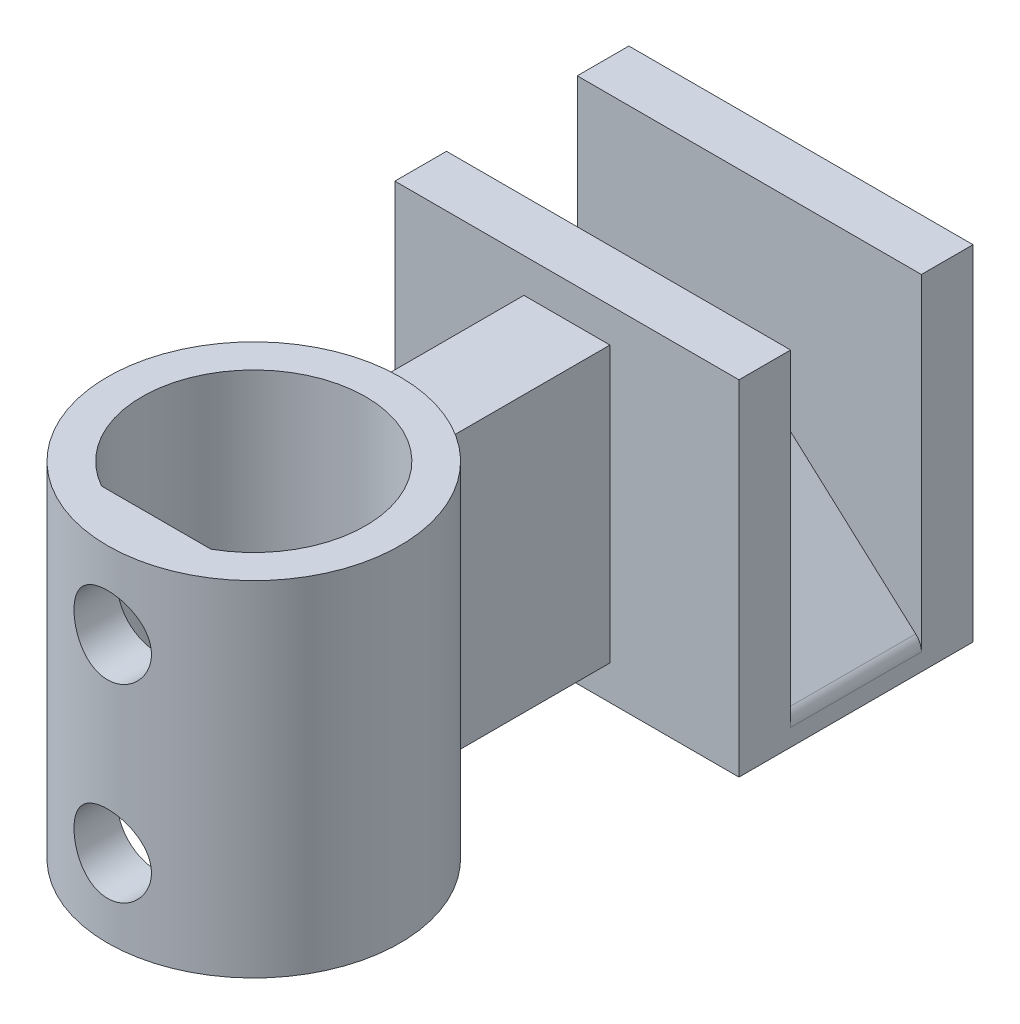
from build123d import *

# Parameters (mm, degrees)
SKETCH2_W                       = 20
SKETCH2_H                       = 10
BOSS_EXTRUDE1_DEPTH             = 3.8
CHAMFER1_SIZE                   = 9.5
CHAMFER1_SIZE2                  = 8.553838421
FILLET3_R                       = 1
SKETCH3_W                       = 20
SKETCH3_H                       = 20
BOSS_EXTRUDE2_DEPTH             = 3
BOSS_EXTRUDE3_REACH             = 21.268
SKETCH6_R                       = 8.5
BOSS_EXTRUDE3_DIRECTION_2_REACH = 21.268
BOSS_EXTRUDE4_REACH             = 34.216
BOSS_EXTRUDE4_END_RADIUS        = 8.5
SKETCH5_W                       = 5
SKETCH5_H                       = 16
CUT_EXTRUDE1_REACH              = 34.299
CUT_EXTRUDE1_END_RADIUS         = 8.5
SKETCH7_R                       = 2.25


with BuildPart() as part:
    # Sketch2 → Boss-Extrude1 (new, symmetric)
    with BuildSketch(Plane.XY):
        Rectangle(SKETCH2_W, SKETCH2_H)
    extrude(amount=BOSS_EXTRUDE1_DEPTH, both=True)

    # Chamfer1
    chamfer1_edges = [part.edges().sort_by_distance(p)[0] for p in [
        (-10, 5, 0),
        (10, 5, 0),
    ]]
    chamfer1_side = [part.faces().sort_by_distance(p)[0] for p in [
        (0, 5, 0),
    ]]
    chamfer(chamfer1_edges, length=CHAMFER1_SIZE, length2=CHAMFER1_SIZE2, reference=chamfer1_side[0])

    # Fillet3
    fillet3_edges = [part.edges().sort_by_distance(p)[0] for p in [
        (-0.5, 5, 0),
        (0.5, 5, 0),
        (10, -3.553838421, 0),
        (-10, -3.553838421, 0),
    ]]
    fillet(fillet3_edges, radius=FILLET3_R)

    # Sketch3 → Boss-Extrude2 (add)
    with BuildSketch(Plane.XY.offset(3.8)):
        with Locations((0, 5)):
            Rectangle(SKETCH3_W, SKETCH3_H)
    boss_extrude2 = extrude(amount=BOSS_EXTRUDE2_DEPTH)

    # Mirror1: Boss-Extrude2 across plane
    add(boss_extrude2.mirror(Plane.XY))


with BuildPart() as body_2:

    # Boss-Extrude3: up to this face of the body (flat: up to its plane)
    boss_extrude3_end = Plane(part.part.faces().sort_by_distance((0, 15, 5.3))[0])
    # Sketch6 → Boss-Extrude3 (new, up to the picked face)
    with BuildSketch(Plane(origin=(0, 0, 0), x_dir=(1, 0, 0), z_dir=(0, 1, 0)), mode=Mode.PRIVATE) as boss_extrude3_sk1:
        with Locations(Location((0, -25, 0), (0, 0, 90))):
            Circle(SKETCH6_R)
        with BuildLine():
            Line((3.175, -30.671805268), (-3.175, -30.671805268))
            ThreePointArc((-3.175, -30.671805268), (0, -18.5), (3.175, -30.671805268))
        make_face(mode=Mode.SUBTRACT)
    boss_extrude3_tool1 = split(extrude(boss_extrude3_sk1.sketch, amount=BOSS_EXTRUDE3_REACH, mode=Mode.PRIVATE), bisect_by=boss_extrude3_end, keep=Keep.BOTH, mode=Mode.PRIVATE)
    add(boss_extrude3_tool1.solids().sort_by(Axis((0, 0, 33.259584), (0, 1, 0)))[0])


    # Boss-Extrude3 direction 2: up to this face of the body (flat: up to its plane)
    boss_extrude3_direction_2_end = Plane(part.part.faces().sort_by_distance((0, -5, 0))[0])
    # Sketch6 → Boss-Extrude3 direction 2 (add, up to the picked face)
    with BuildSketch(Plane(origin=(0, 0, 0), x_dir=(1, 0, 0), z_dir=(0, 1, 0)), mode=Mode.PRIVATE) as boss_extrude3_direction_2_sk1:
        with Locations(Location((0, -25, 0), (0, 0, 90))):
            Circle(SKETCH6_R)
        with BuildLine():
            Line((3.175, -30.671805268), (-3.175, -30.671805268))
            ThreePointArc((-3.175, -30.671805268), (0, -18.5), (3.175, -30.671805268))
        make_face(mode=Mode.SUBTRACT)
    boss_extrude3_direction_2_tool1 = split(extrude(boss_extrude3_direction_2_sk1.sketch, amount=-BOSS_EXTRUDE3_DIRECTION_2_REACH, mode=Mode.PRIVATE), bisect_by=boss_extrude3_direction_2_end, keep=Keep.BOTH, mode=Mode.PRIVATE)
    add(boss_extrude3_direction_2_tool1.solids().sort_by(Axis((0, 0, 33.259584), (0, -1, 0)))[0])


with BuildPart() as part_1:
    add(part.part)

    add(body_2.part)  # Boss-Extrude4 merges body 2
    # Boss-Extrude4: up to this cylinder (the profile starts outside it)
    boss_extrude4_end = Plane(origin=(0, 5, 25), z_dir=(0, -1, 0)) * Cylinder(BOSS_EXTRUDE4_END_RADIUS, 86.432, mode=Mode.PRIVATE)
    # Sketch5 → Boss-Extrude4 (add, up to the surface)
    with BuildSketch(Plane.XY.offset(6.8), mode=Mode.PRIVATE) as boss_extrude4_sk1:
        with Locations((0, 5)):
            Rectangle(SKETCH5_W, SKETCH5_H)
    boss_extrude4_tool1 = extrude(boss_extrude4_sk1.sketch, amount=BOSS_EXTRUDE4_REACH, mode=Mode.PRIVATE) - boss_extrude4_end
    add(boss_extrude4_tool1.solids().sort_by_distance((0, 5, 6.8))[0])

    # Cut-Extrude1: up to this cylinder (the profile starts inside it)
    cut_extrude1_end = Plane(origin=(0, 5, 25), z_dir=(0, -1, 0)) * Cylinder(CUT_EXTRUDE1_END_RADIUS, 97.598, mode=Mode.PRIVATE)
    # Sketch7 → Cut-Extrude1 (cut, up to the surface)
    with BuildSketch(Plane.XY.offset(20), mode=Mode.PRIVATE) as cut_extrude1_sk1:
        with Locations(Location((0, 10.5, 0), (0, 0, 180))):
            Circle(SKETCH7_R)
    cut_extrude1_tool1 = extrude(cut_extrude1_sk1.sketch, amount=CUT_EXTRUDE1_REACH, mode=Mode.PRIVATE) & cut_extrude1_end
    add(cut_extrude1_tool1.solids().sort_by_distance((0, 10.5, 20))[0], mode=Mode.SUBTRACT)
    # Sketch7 → Cut-Extrude1 (cut, up to the surface)
    with BuildSketch(Plane.XY.offset(20), mode=Mode.PRIVATE) as cut_extrude1_sk2:
        with Locations(Location((0, -0.5, 0), (0, 0, 180))):
            Circle(SKETCH7_R)
    cut_extrude1_tool2 = extrude(cut_extrude1_sk2.sketch, amount=CUT_EXTRUDE1_REACH, mode=Mode.PRIVATE) & cut_extrude1_end
    add(cut_extrude1_tool2.solids().sort_by_distance((0, -0.5, 20))[0], mode=Mode.SUBTRACT)


solid = part_1.part
